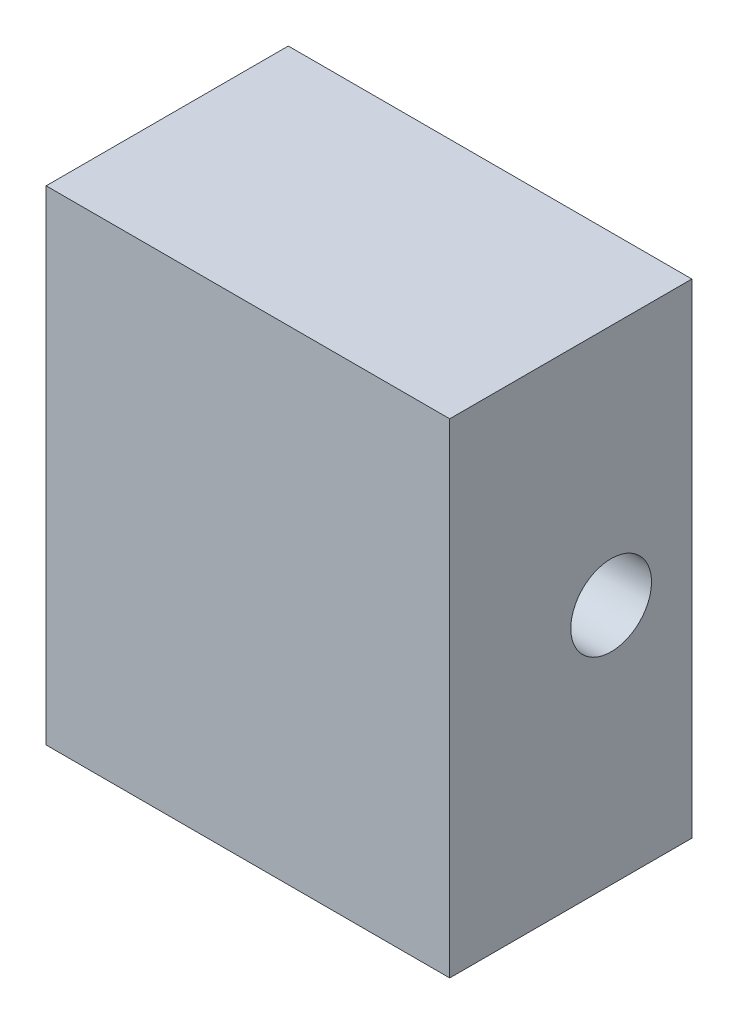
from build123d import *

# Parameters (mm, degrees)
SKETCH1_W           = 25
SKETCH1_H           = 30
BOSS_EXTRUDE1_DEPTH = 15
SKETCH2_R           = 2.5
CUT_EXTRUDE1_DEPTH  = 26


with BuildPart() as part:
    # Sketch1 → Boss-Extrude1 (new body)
    with BuildSketch(Plane.XY):
        Rectangle(SKETCH1_W, SKETCH1_H)
    extrude(amount=BOSS_EXTRUDE1_DEPTH)

    # Sketch2 → Cut-Extrude1 (cut)
    with BuildSketch(Plane.ZY.offset(12.5)):
        with Locations((5, 0)):
            Circle(SKETCH2_R)
    extrude(amount=-CUT_EXTRUDE1_DEPTH, mode=Mode.SUBTRACT)


solid = part.part
